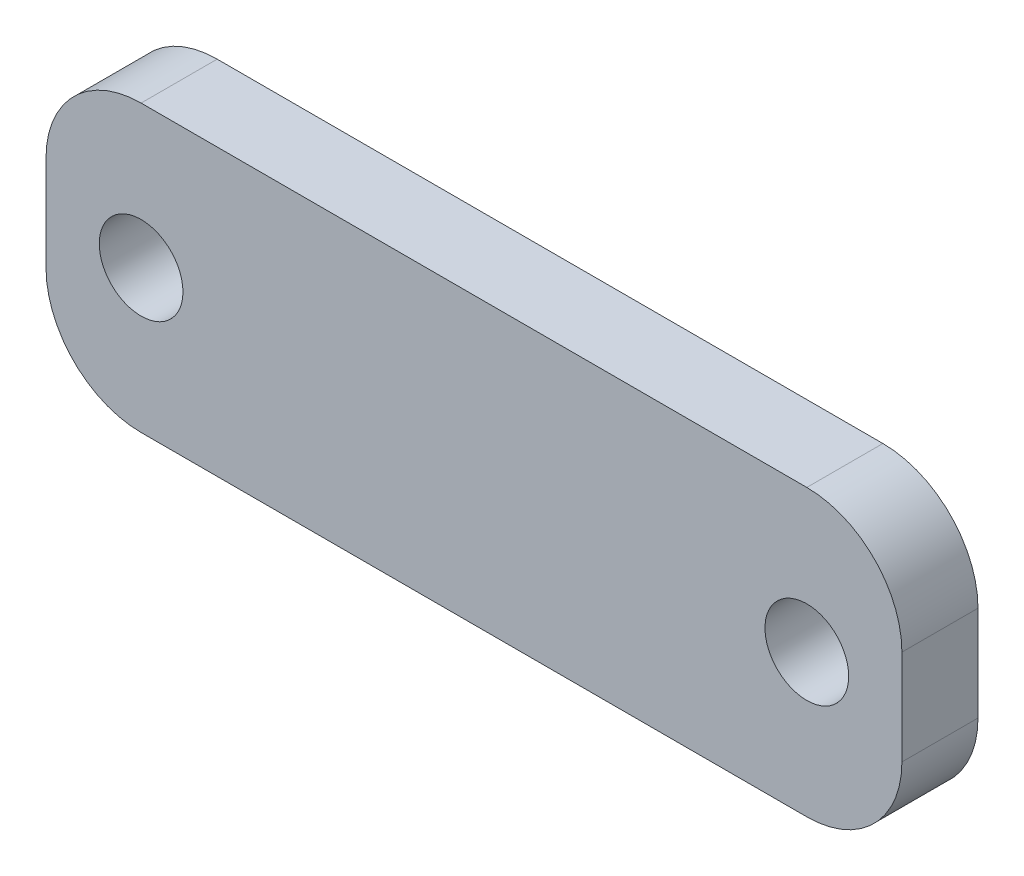
from build123d import *

# Parameters (mm, degrees)
CROQUIS1_W              = 45
CROQUIS1_H              = 15
CROQUIS1_R              = 2.2
SALIENTE_EXTRUIR1_DEPTH = 4
REDONDEO1_R             = 5


with BuildPart() as part:
    # Croquis1 → Saliente-Extruir1 (new body)
    with BuildSketch(Plane.XY):
        with Locations((22.5, 7.5)):
            Rectangle(CROQUIS1_W, CROQUIS1_H)
        with Locations((5, 7.5)):
            Circle(CROQUIS1_R, mode=Mode.SUBTRACT)
        with Locations((40, 7.5)):
            Circle(CROQUIS1_R, mode=Mode.SUBTRACT)
    extrude(amount=SALIENTE_EXTRUIR1_DEPTH)

    # Redondeo1
    redondeo1_edges = [part.edges().sort_by_distance(p)[0] for p in [
        (0, 0, 2),
        (0, 15, 2),
        (45, 15, 2),
        (45, 0, 2),
    ]]
    fillet(redondeo1_edges, radius=REDONDEO1_R)


solid = part.part
